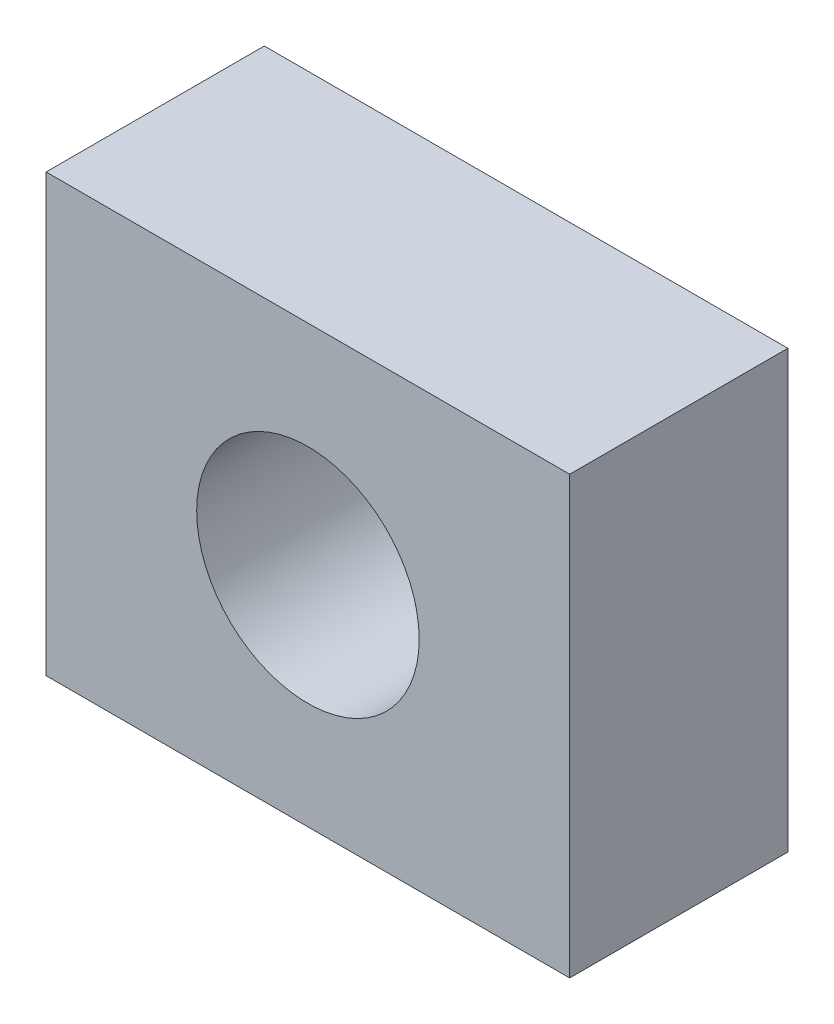
from build123d import *

# Parameters (mm, degrees)
SKETCH_1_W      = 12
SKETCH_1_H      = 10
SKETCH_1_R      = 2.55
EXTRUDE_1_DEPTH = 5


with BuildPart() as part:
    # 草圖1 → 填料-伸長1 (new body)
    with BuildSketch(Plane.XY):
        Rectangle(SKETCH_1_W, SKETCH_1_H)
        Circle(SKETCH_1_R, mode=Mode.SUBTRACT)
    extrude(amount=EXTRUDE_1_DEPTH)


solid = part.part
